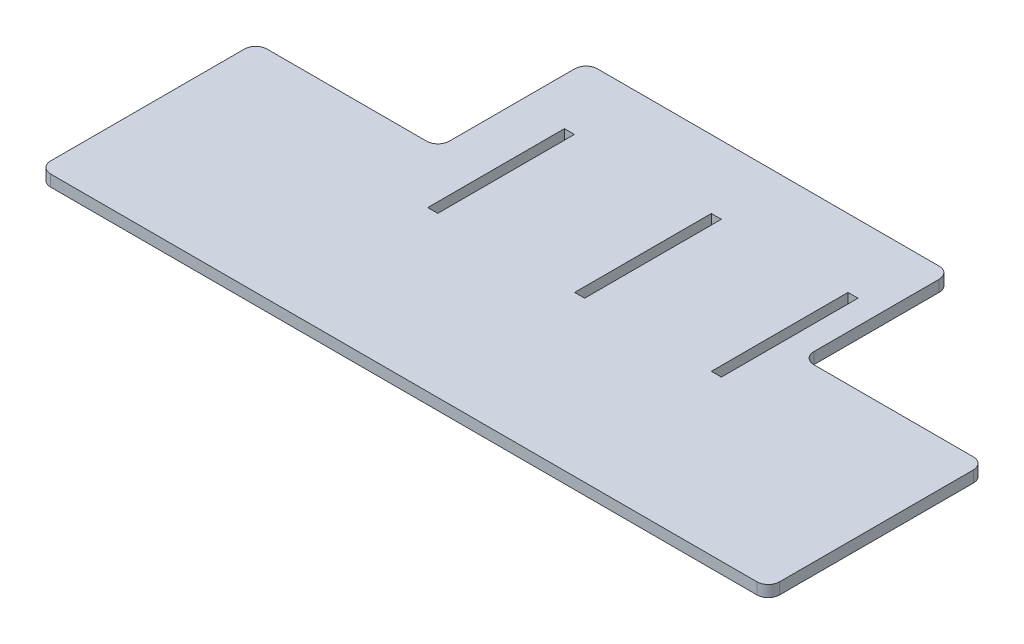
from build123d import *

# Parameters (mm, degrees)
BOSS_EXTRUDE1_DEPTH = 3.175
SKETCH2_W           = 2.794
SKETCH2_H           = 38.1
CUT_EXTRUDE1_DEPTH  = 3.175
FILLET1_R           = 3.175
SKETCH3_W           = 2.794
SKETCH3_H           = 38.1
CUT_EXTRUDE2_DEPTH  = 9.525
SKETCH4_W           = 2.794
SKETCH4_H           = 38.1
CUT_EXTRUDE3_DEPTH  = 3.175


with BuildPart() as part:
    # Sketch1 → Boss-Extrude1 (new body)
    with BuildSketch(Plane(origin=(0, 0, 0), x_dir=(1, 0, 0), z_dir=(0, 1, 0))):
        Polygon((50.8, 30.1625), (101.6, 30.1625), (101.6, -30.1625), (-101.6, -30.1625), (-101.6, 30.1625), (-50.8, 30.1625), (-50.8, 71.4375), (50.8, 71.4375), align=None)
    extrude(amount=BOSS_EXTRUDE1_DEPTH)

    # Sketch2 → Cut-Extrude1 (cut)
    with BuildSketch(Plane(origin=(0, 3.175, 0), x_dir=(1, 0, 0), z_dir=(0, 1, 0))):
        with Locations((4.572, 33.3375)):
            Rectangle(SKETCH2_W, SKETCH2_H)
    extrude(amount=-CUT_EXTRUDE1_DEPTH, mode=Mode.SUBTRACT)

    # Fillet1
    fillet1_edges = [part.edges().sort_by_distance(p)[0] for p in [
        (101.6, 1.5875, 30.1625),
        (-101.6, 1.5875, 30.1625),
        (-101.6, 1.5875, -30.1625),
        (-50.8, 1.5875, -30.1625),
        (-50.8, 1.5875, -71.4375),
        (50.8, 1.5875, -71.4375),
        (50.8, 1.5875, -30.1625),
        (101.6, 1.5875, -30.1625),
    ]]
    fillet(fillet1_edges, radius=FILLET1_R)

    # Sketch3 → Cut-Extrude2 (cut)
    with BuildSketch(Plane(origin=(0, 3.175, 0), x_dir=(1, 0, 0), z_dir=(0, 1, 0))):
        with Locations((-36.3855, 33.3375)):
            Rectangle(SKETCH3_W, SKETCH3_H)
    extrude(amount=-CUT_EXTRUDE2_DEPTH, mode=Mode.SUBTRACT)

    # Sketch4 → Cut-Extrude3 (cut)
    with BuildSketch(Plane(origin=(0, 3.175, 0), x_dir=(1, 0, 0), z_dir=(0, 1, 0))):
        with Locations((42.672, 33.3375)):
            Rectangle(SKETCH4_W, SKETCH4_H)
    extrude(amount=-CUT_EXTRUDE3_DEPTH, mode=Mode.SUBTRACT)


solid = part.part
